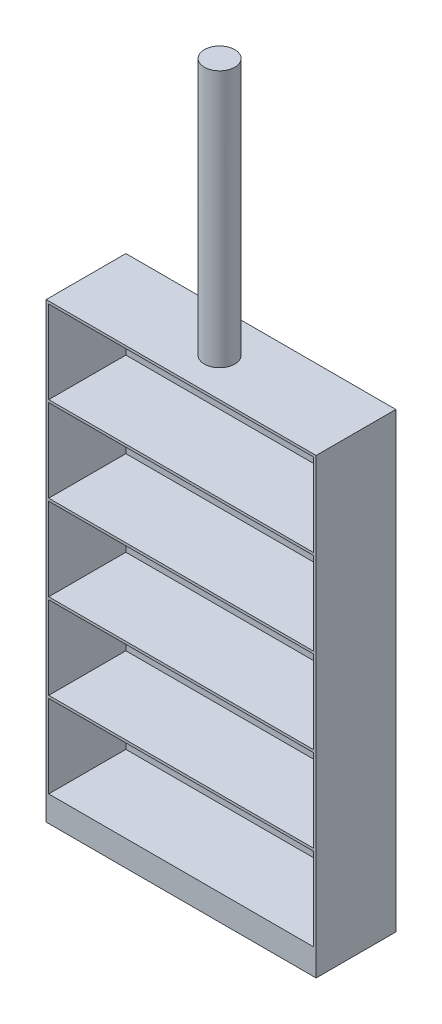
from build123d import *

# Parameters (mm, degrees)
CROQUIS1_W              = 1050
CROQUIS1_H              = 1760
SALIENTE_EXTRUIR1_DEPTH = 10
CROQUIS2_W              = 1050
CROQUIS2_H              = 1760
CROQUIS2_W_2            = 1030
CROQUIS2_H_2            = 322
SALIENTE_EXTRUIR2_DEPTH = 300
CROQUIS3_R              = 59.221994718
SALIENTE_EXTRUIR3_DEPTH = 1000


with BuildPart() as part:
    # Croquis1 → Saliente-Extruir1 (new body)
    with BuildSketch(Plane.XY):
        Rectangle(CROQUIS1_W, CROQUIS1_H)
    extrude(amount=SALIENTE_EXTRUIR1_DEPTH)

    # Croquis2 → Saliente-Extruir2 (add)
    with BuildSketch(Plane.XY.offset(10)):
        Rectangle(CROQUIS2_W, CROQUIS2_H)
        with Locations((0, 377)):
            Rectangle(CROQUIS2_W_2, CROQUIS2_H_2, mode=Mode.SUBTRACT)
        with Locations((0, 709)):
            Rectangle(CROQUIS2_W_2, CROQUIS2_H_2, mode=Mode.SUBTRACT)
        with Locations((0, 45)):
            Rectangle(CROQUIS2_W_2, CROQUIS2_H_2, mode=Mode.SUBTRACT)
        with Locations((0, -287)):
            Rectangle(CROQUIS2_W_2, CROQUIS2_H_2, mode=Mode.SUBTRACT)
        with Locations((0, -619)):
            Rectangle(CROQUIS2_W_2, CROQUIS2_H_2, mode=Mode.SUBTRACT)
    extrude(amount=SALIENTE_EXTRUIR2_DEPTH)

    # Croquis3 → Saliente-Extruir3 (add)
    with BuildSketch(Plane(origin=(0, 880, 0), x_dir=(1, 0, 0), z_dir=(0, 1, 0))):
        with Locations(Location((0, -160.46266829, 0), (0, 0, 90))):
            Circle(CROQUIS3_R)
    extrude(amount=SALIENTE_EXTRUIR3_DEPTH)


solid = part.part
